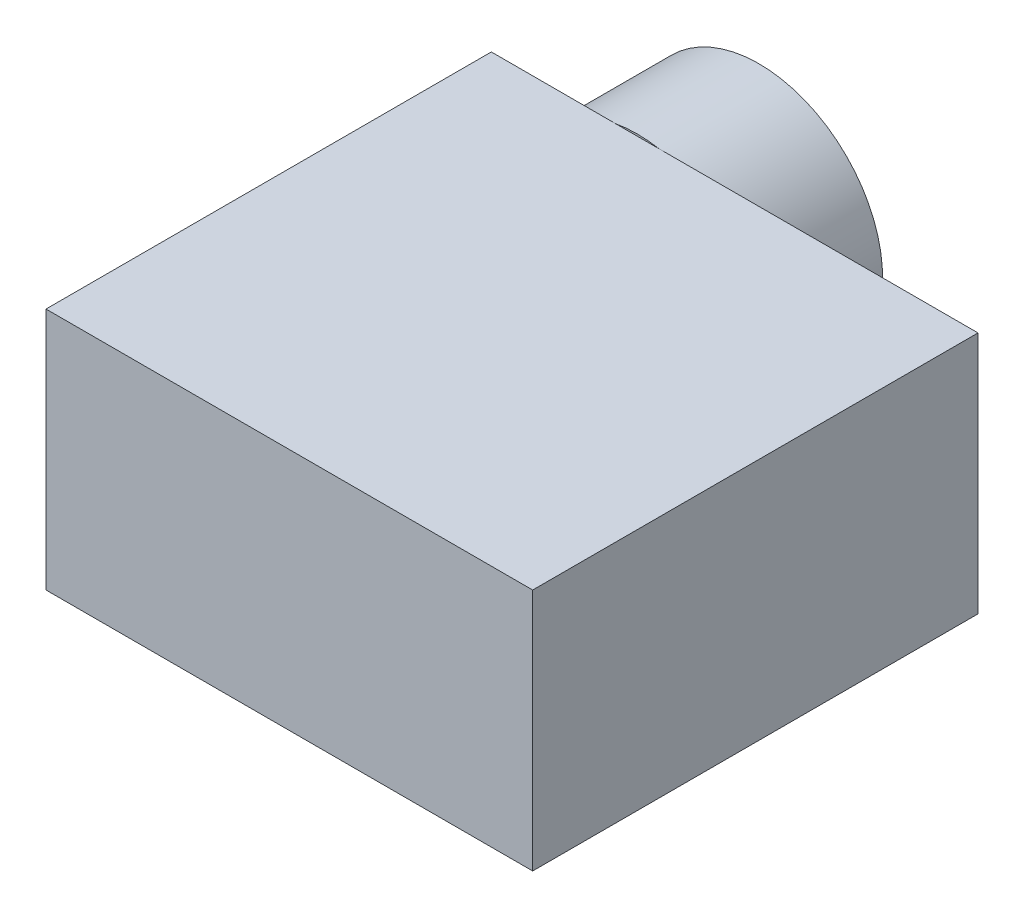
from build123d import *

# Parameters (mm, degrees)
SKETCH1_W           = 40
SKETCH1_H           = 36.6
BOSS_EXTRUDE1_DEPTH = 10
SKETCH2_R           = 10.16
BOSS_EXTRUDE2_DEPTH = 10


with BuildPart() as part:
    # Sketch1 → Boss-Extrude1 (new, symmetric)
    with BuildSketch(Plane(origin=(0, 0, 0), x_dir=(1, 0, 0), z_dir=(0, 1, 0))):
        with Locations((8, -8.3)):
            Rectangle(SKETCH1_W, SKETCH1_H)
    extrude(amount=BOSS_EXTRUDE1_DEPTH, both=True)

    # Sketch2 → Boss-Extrude2 (add)
    with BuildSketch(Plane(origin=(0, 0, -10), x_dir=(-1, 0, 0), z_dir=(0, 0, -1))):
        with Locations(Location((0, 0, 0), (0, 0, 100.181748388))):
            Circle(SKETCH2_R)
    extrude(amount=BOSS_EXTRUDE2_DEPTH)


solid = part.part
